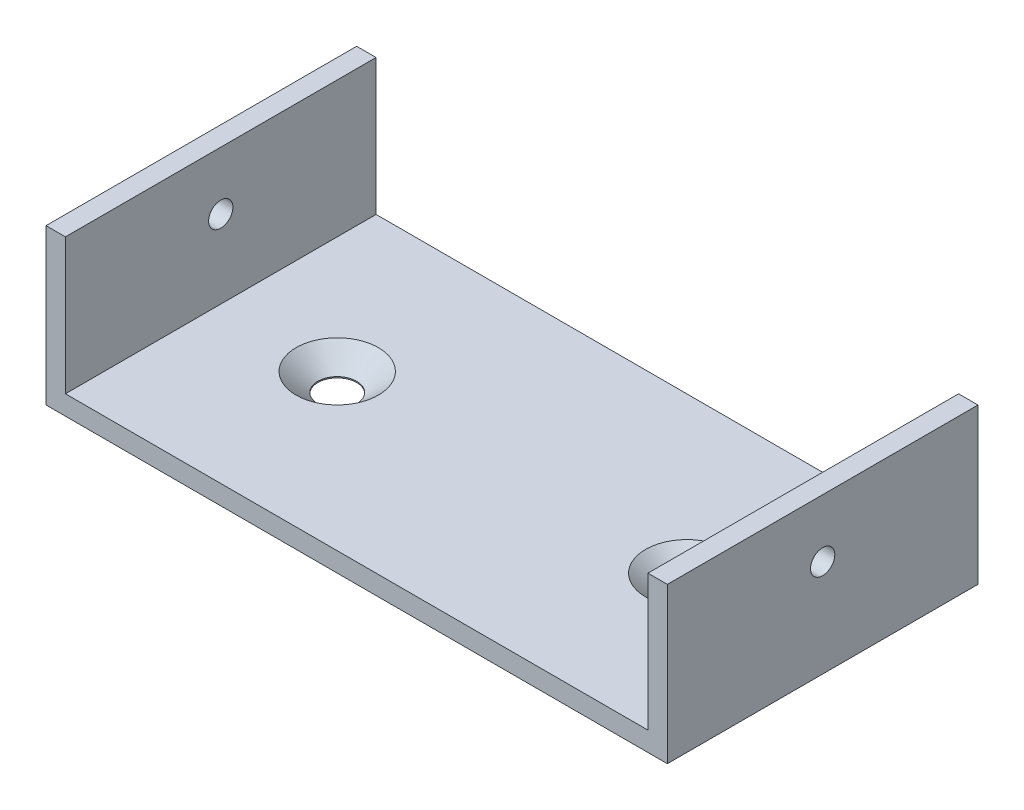
from build123d import *

# Parameters (mm, degrees)
BOSS_EXTRUDE2_DEPTH                  = 25.4
F_1_4_0_25_DIAMETER_HOLE1_AT_2_COUNT = 2
F_1_4_0_25_DIAMETER_HOLE1_AT_2_PITCH = 57.15
F_5_32_0_15625_DIAMETER_HOLE1_D      = 3.96875


with BuildPart() as part:
    # Sketch3 → Boss-Extrude2 (new, symmetric)
    with BuildSketch(Plane.XY):
        Polygon((-50.8, 12.7), (-50.8, -12.7), (50.8, -12.7), (50.8, 12.7), (47.625, 12.7), (47.625, -9.525), (-47.625, -9.525), (-47.625, 12.7), align=None)
    extrude(amount=BOSS_EXTRUDE2_DEPTH, both=True)

    # Sketch6 → 1/4 (0.25) Diameter Hole1 (revolve, cut)
    with BuildSketch(Plane(origin=(-28.575, -9.525, 0), x_dir=(0, 0, 1), z_dir=(1, 0, 0))):
        Polygon((0, 0), (0, 3.175), (3.175, 3.175), (3.175, 2.983838288), (6.731, 0), align=None)
    f_1_4_0_25_diameter_hole1 = revolve(axis=Axis((-28.575, -3.175, 0), (0, -1, 0)), mode=Mode.SUBTRACT)

    # 1/4 (0.25) Diameter Hole1 at 2: 1/4 (0.25) Diameter Hole1 ×2
    with Locations(*[(i * F_1_4_0_25_DIAMETER_HOLE1_AT_2_PITCH, 0, 0) for i in range(1, F_1_4_0_25_DIAMETER_HOLE1_AT_2_COUNT)]):
        add(f_1_4_0_25_diameter_hole1, mode=Mode.SUBTRACT)

    # 5/32 (0.15625) Diameter Hole1 (through all)
    with Locations(Plane(origin=(50.8, 0, 0), x_dir=(0, 0, -1), z_dir=(1, 0, 0))):
        with Locations((0, 3.215843377)):
            Hole(F_5_32_0_15625_DIAMETER_HOLE1_D / 2)


solid = part.part
